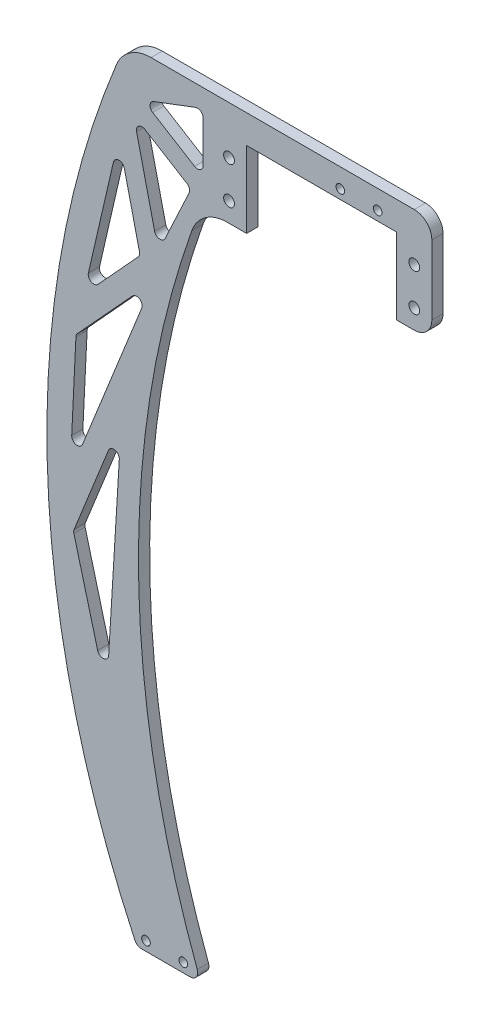
from build123d import *

# Parameters (mm, degrees)
BOSS_EXTRU_1_DEPTH      = 3
ENL_V_MAT_EXTRU_1_REACH = 209.016
ESQUISSE2_W             = 40.2
ESQUISSE2_H             = 20.4
ENL_V_MAT_EXTRU_2_REACH = 209.016
ESQUISSE3_R             = 1.45
CONG_2_R                = 4.7
CONG_3_R                = 10
CONG_5_R                = 2
ENL_V_MAT_EXTRU_3_REACH = 209.016
CONG_6_R                = 1.5
ENL_V_MAT_EXTRU_4_REACH = 209.016
ESQUISSE5_R             = 1.15
ESQUISSE6_R             = 1.15
ENL_V_MAT_EXTRU_5_DEPTH = 10


with BuildPart() as part:
    # Esquisse1 → Boss.-Extru.1 (new body)
    with BuildSketch(Plane.XY):
        with BuildLine():
            Line((-30.9, -14), (30.9, -14))
            Line((30.9, -14), (30.9, 14))
            Line((30.9, 14), (-50.9, 14))
            ThreePointArc((-50.9, 14), (-72.161104257, -90.305053327), (-48.1, -194))
            Line((-48.1, -194), (-30.9, -194))
            ThreePointArc((-30.9, -194), (-47.661924206, -104), (-30.9, -14))
        make_face()
    extrude(amount=BOSS_EXTRU_1_DEPTH)

    # Esquisse2 → Enlèv. mat.-Extru.1 (cut, up to next)
    with BuildSketch(Plane.XY.offset(3), mode=Mode.PRIVATE) as enl_v_mat_extru_1_sk1:
        with Locations((1.4, -3.8)):
            Rectangle(ESQUISSE2_W, ESQUISSE2_H)
    enl_v_mat_extru_1_tool1 = extrude(enl_v_mat_extru_1_sk1.sketch, amount=-ENL_V_MAT_EXTRU_1_REACH, mode=Mode.PRIVATE) & part.part
    add(enl_v_mat_extru_1_tool1.solids().sort_by_distance((1.4, -3.8, 3))[0], mode=Mode.SUBTRACT)

    # Esquisse3 → Enlèv. mat.-Extru.2 (cut, up to next)
    with BuildSketch(Plane.XY.offset(3), mode=Mode.PRIVATE) as enl_v_mat_extru_2_sk1:
        with Locations((26.2, -8.8)):
            Circle(ESQUISSE3_R)
    enl_v_mat_extru_2_tool1 = extrude(enl_v_mat_extru_2_sk1.sketch, amount=-ENL_V_MAT_EXTRU_2_REACH, mode=Mode.PRIVATE) & part.part
    # Esquisse3 → Enlèv. mat.-Extru.2 (cut, up to next)
    with BuildSketch(Plane.XY.offset(3), mode=Mode.PRIVATE) as enl_v_mat_extru_2_sk2:
        with Locations((-23.4, -8.8)):
            Circle(ESQUISSE3_R)
    enl_v_mat_extru_2_tool2 = extrude(enl_v_mat_extru_2_sk2.sketch, amount=-ENL_V_MAT_EXTRU_2_REACH, mode=Mode.PRIVATE) & part.part
    # Esquisse3 → Enlèv. mat.-Extru.2 (cut, up to next)
    with BuildSketch(Plane.XY.offset(3), mode=Mode.PRIVATE) as enl_v_mat_extru_2_sk3:
        with Locations((-23.4, 1.2)):
            Circle(ESQUISSE3_R)
    enl_v_mat_extru_2_tool3 = extrude(enl_v_mat_extru_2_sk3.sketch, amount=-ENL_V_MAT_EXTRU_2_REACH, mode=Mode.PRIVATE) & part.part
    # Esquisse3 → Enlèv. mat.-Extru.2 (cut, up to next)
    with BuildSketch(Plane.XY.offset(3), mode=Mode.PRIVATE) as enl_v_mat_extru_2_sk4:
        with Locations((26.2, 1.2)):
            Circle(ESQUISSE3_R)
    enl_v_mat_extru_2_tool4 = extrude(enl_v_mat_extru_2_sk4.sketch, amount=-ENL_V_MAT_EXTRU_2_REACH, mode=Mode.PRIVATE) & part.part
    add(enl_v_mat_extru_2_tool1.solids().sort_by_distance((26.2, -8.8, 3))[0], mode=Mode.SUBTRACT)
    add(enl_v_mat_extru_2_tool2.solids().sort_by_distance((-23.4, -8.8, 3))[0], mode=Mode.SUBTRACT)
    add(enl_v_mat_extru_2_tool3.solids().sort_by_distance((-23.4, 1.2, 3))[0], mode=Mode.SUBTRACT)
    add(enl_v_mat_extru_2_tool4.solids().sort_by_distance((26.2, 1.2, 3))[0], mode=Mode.SUBTRACT)

    # Congé2
    cong_2_edges = [part.edges().sort_by_distance(p)[0] for p in [
        (30.9, -14, 1.5),
        (30.9, 14, 1.5),
    ]]
    fillet(cong_2_edges, radius=CONG_2_R)

    # Congé3
    cong_3_edges = [part.edges().sort_by_distance(p)[0] for p in [
        (-30.9, -14, 1.5),
        (-50.9, 14, 1.5),
    ]]
    fillet(cong_3_edges, radius=CONG_3_R)

    # Congé5
    cong_5_edges = [part.edges().sort_by_distance(p)[0] for p in [
        (-30.9, -194, 1.5),
        (-48.1, -194, 1.5),
    ]]
    fillet(cong_5_edges, radius=CONG_5_R)

    # Esquisse4 → Enlèv. mat.-Extru.3 (cut, up to next)
    with BuildSketch(Plane.XY.offset(3), mode=Mode.PRIVATE) as enl_v_mat_extru_3_sk1:
        Polygon((-33.536552076, -11.101012911), (-42.351911307, -30.013593499), (-48.987474587, -1.620621605), align=None)
    enl_v_mat_extru_3_tool1 = extrude(enl_v_mat_extru_3_sk1.sketch, amount=-ENL_V_MAT_EXTRU_3_REACH, mode=Mode.PRIVATE) & part.part
    # Esquisse4 → Enlèv. mat.-Extru.3 (cut, up to next)
    with BuildSketch(Plane.XY.offset(3), mode=Mode.PRIVATE) as enl_v_mat_extru_3_sk2:
        Polygon((-52.917399073, -8.972975376), (-47.213856869, -33.377913835), (-62.359919338, -49.92921121), align=None)
    enl_v_mat_extru_3_tool2 = extrude(enl_v_mat_extru_3_sk2.sketch, amount=-ENL_V_MAT_EXTRU_3_REACH, mode=Mode.PRIVATE) & part.part
    # Esquisse4 → Enlèv. mat.-Extru.3 (cut, up to next)
    with BuildSketch(Plane.XY.offset(3), mode=Mode.PRIVATE) as enl_v_mat_extru_3_sk3:
        Polygon((-43.711860923, -37.698000672), (-64.383676275, -60.287724165), (-65.97140029, -93.194177891), align=None)
    enl_v_mat_extru_3_tool3 = extrude(enl_v_mat_extru_3_sk3.sketch, amount=-ENL_V_MAT_EXTRU_3_REACH, mode=Mode.PRIVATE) & part.part
    # Esquisse4 → Enlèv. mat.-Extru.3 (cut, up to next)
    with BuildSketch(Plane.XY.offset(3), mode=Mode.PRIVATE) as enl_v_mat_extru_3_sk4:
        Polygon((-46.457316631, 3.078230456), (-30.351945171, -6.80371824), (-30.351945171, 9.155359803), align=None)
    enl_v_mat_extru_3_tool4 = extrude(enl_v_mat_extru_3_sk4.sketch, amount=-ENL_V_MAT_EXTRU_3_REACH, mode=Mode.PRIVATE) & part.part
    # Esquisse4 → Enlèv. mat.-Extru.3 (cut, up to next)
    with BuildSketch(Plane.XY.offset(3), mode=Mode.PRIVATE) as enl_v_mat_extru_3_sk5:
        Polygon((-52.234282619, -74.177445722), (-65.087399313, -106.222081959), (-56.206990273, -139.61663464), align=None)
    enl_v_mat_extru_3_tool5 = extrude(enl_v_mat_extru_3_sk5.sketch, amount=-ENL_V_MAT_EXTRU_3_REACH, mode=Mode.PRIVATE) & part.part
    add(enl_v_mat_extru_3_tool1.solids().sort_by_distance((-41.625313, -14.245076, 3))[0], mode=Mode.SUBTRACT)
    add(enl_v_mat_extru_3_tool2.solids().sort_by_distance((-54.163725, -30.760033, 3))[0], mode=Mode.SUBTRACT)
    add(enl_v_mat_extru_3_tool3.solids().sort_by_distance((-58.022312, -63.726634, 3))[0], mode=Mode.SUBTRACT)
    add(enl_v_mat_extru_3_tool4.solids().sort_by_distance((-35.720402, 1.809957, 3))[0], mode=Mode.SUBTRACT)
    add(enl_v_mat_extru_3_tool5.solids().sort_by_distance((-57.842891, -106.672054, 3))[0], mode=Mode.SUBTRACT)

    # Congé6
    cong_6_edges = [part.edges().sort_by_distance(p)[0] for p in [
        (-62.359919338, -49.92921121, 1.5),
        (-52.917399073, -8.972975376, 1.5),
        (-47.213856869, -33.377913835, 1.5),
        (-46.457316631, 3.078230456, 1.5),
        (-30.351945171, 9.155359803, 1.5),
        (-30.351945171, -6.80371824, 1.5),
        (-52.234282619, -74.177445722, 1.5),
        (-56.206990273, -139.61663464, 1.5),
        (-65.087399313, -106.222081959, 1.5),
        (-43.711860923, -37.698000672, 1.5),
        (-65.97140029, -93.194177891, 1.5),
        (-64.383676275, -60.287724165, 1.5),
        (-48.987474587, -1.620621605, 1.5),
        (-33.536552076, -11.101012911, 1.5),
        (-42.351911307, -30.013593499, 1.5),
    ]]
    fillet(cong_6_edges, radius=CONG_6_R)

    # Esquisse5 → Enlèv. mat.-Extru.4 (cut, up to next)
    with BuildSketch(Plane.XY.offset(3), mode=Mode.PRIVATE) as enl_v_mat_extru_4_sk1:
        with Locations((16.4, 8.9)):
            Circle(ESQUISSE5_R)
    enl_v_mat_extru_4_tool1 = extrude(enl_v_mat_extru_4_sk1.sketch, amount=-ENL_V_MAT_EXTRU_4_REACH, mode=Mode.PRIVATE) & part.part
    # Esquisse5 → Enlèv. mat.-Extru.4 (cut, up to next)
    with BuildSketch(Plane.XY.offset(3), mode=Mode.PRIVATE) as enl_v_mat_extru_4_sk2:
        with Locations((6.4, 8.9)):
            Circle(ESQUISSE5_R)
    enl_v_mat_extru_4_tool2 = extrude(enl_v_mat_extru_4_sk2.sketch, amount=-ENL_V_MAT_EXTRU_4_REACH, mode=Mode.PRIVATE) & part.part
    add(enl_v_mat_extru_4_tool1.solids().sort_by_distance((16.4, 8.9, 3))[0], mode=Mode.SUBTRACT)
    add(enl_v_mat_extru_4_tool2.solids().sort_by_distance((6.4, 8.9, 3))[0], mode=Mode.SUBTRACT)

    # Esquisse6 → Enlèv. mat.-Extru.5 (cut)
    with BuildSketch(Plane.XY.offset(3)):
        with Locations((-45.64268297, -191.5)):
            Circle(ESQUISSE6_R)
        with Locations((-35.64268297, -191.5)):
            Circle(ESQUISSE6_R)
    extrude(amount=-ENL_V_MAT_EXTRU_5_DEPTH, mode=Mode.SUBTRACT)


solid = part.part
